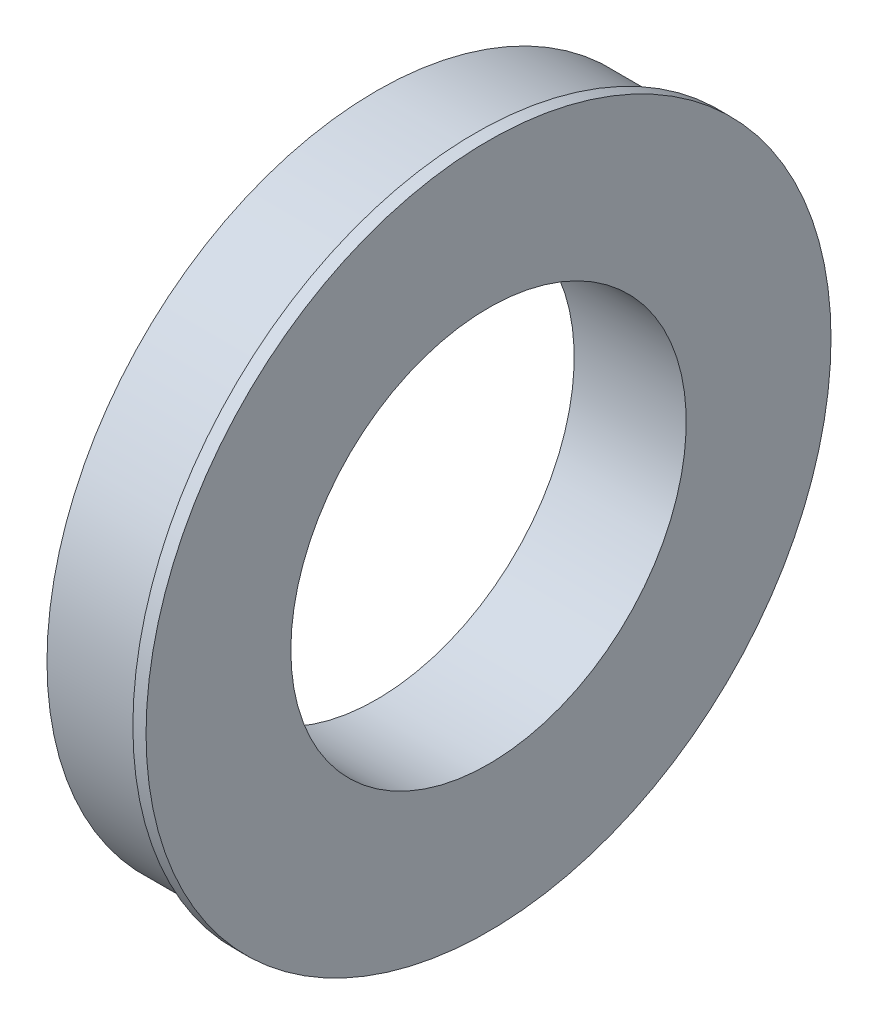
from build123d import *

# Parameters (mm, degrees)
SKETCH1_R           = 63.5
SKETCH1_R_2         = 38.1
BOSS_EXTRUDE1_DEPTH = 19.05
SKETCH3_R           = 66
SKETCH3_R_2         = 38.1
BOSS_EXTRUDE2_DEPTH = 2.54


with BuildPart() as part:
    # Sketch1 → Boss-Extrude1 (new body)
    with BuildSketch(Plane(origin=(0, 0, 0), x_dir=(0, 0, -1), z_dir=(1, 0, 0))):
        with Locations(Location((0, 0, 0), (0, 0, 180))):
            Circle(SKETCH1_R)
        with Locations(Location((0, 0, 0), (0, 0, 180))):
            Circle(SKETCH1_R_2, mode=Mode.SUBTRACT)
    extrude(amount=BOSS_EXTRUDE1_DEPTH)

    # Sketch3 → Boss-Extrude2 (add)
    with BuildSketch(Plane(origin=(19.05, 0, 0), x_dir=(0, 0, -1), z_dir=(1, 0, 0))):
        Circle(SKETCH3_R)
        with Locations(Location((0, 0, 0), (0, 0, 180))):
            Circle(SKETCH3_R_2, mode=Mode.SUBTRACT)
    extrude(amount=BOSS_EXTRUDE2_DEPTH)


solid = part.part
